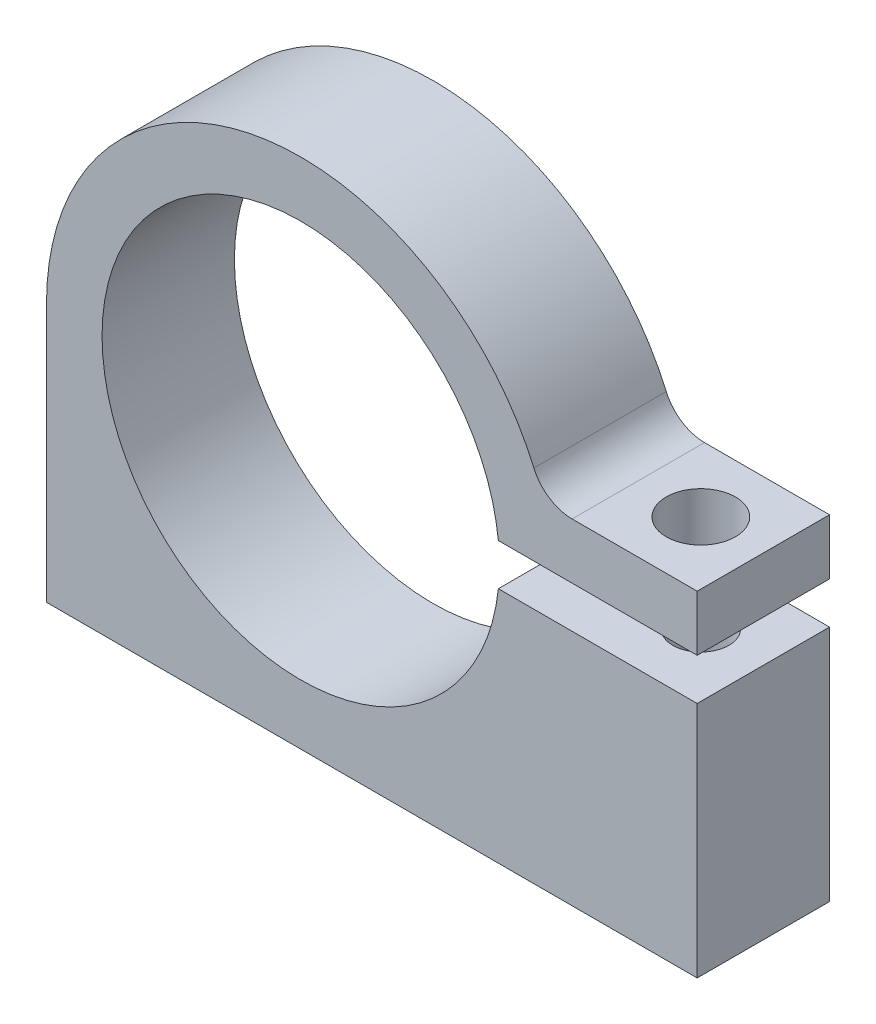
from build123d import *

# Parameters (mm, degrees)
BOSS_EXTRUDE1_DEPTH        = 9.525
F_10_CLEARANCE_HOLE1_D     = 4.9784
F_10_CLEARANCE_HOLE1_DEPTH = 4
F_10_CLEARANCE_HOLE1_TIP   = 1.495662253
F_10_32_TAPPED_HOLE1_D     = 4.0386
F_10_32_TAPPED_HOLE2_D     = 4.0386
F_10_32_TAPPED_HOLE2_DEPTH = 7
F_10_32_TAPPED_HOLE2_TIP   = 1.213317848


with BuildPart() as part:
    # Sketch1 → Boss-Extrude1 (new body)
    with BuildSketch(Plane.XY):
        with BuildLine():
            ThreePointArc((14.221111068, -1.5), (-14.3, 0), (14.221111068, 1.5))
            Line((14.221111068, 1.5), (28.530488985, 1.5))
            Line((28.530488985, 1.5), (28.530488985, 5.5))
            Line((28.530488985, 5.5), (19.530488985, 5.5))
            ThreePointArc((19.530488985, 5.5), (17.886036082, 5.990861772), (16.779715889, 7.302816901))
            ThreePointArc((16.779715889, 7.302816901), (-3.729691625, 17.915897979), (-18.3, 0))
            Line((-18.3, 0), (-18.3, -18.61))
            Line((-18.3, -18.61), (28.530488985, -18.61))
            Line((28.530488985, -18.61), (28.530488985, -1.5))
            Line((28.530488985, -1.5), (14.221111068, -1.5))
        make_face()
    extrude(amount=BOSS_EXTRUDE1_DEPTH)

    # #10 Clearance Hole1
    with Locations(Plane(origin=(0, 5.5, 0), x_dir=(1, 0, 0), z_dir=(0, 1, 0))):
        with Locations((24.030488985, -4.7625)):
            Hole(F_10_CLEARANCE_HOLE1_D / 2, depth=F_10_CLEARANCE_HOLE1_DEPTH)
            with Locations((0, 0, -(F_10_CLEARANCE_HOLE1_DEPTH + F_10_CLEARANCE_HOLE1_TIP / 2))):  # 118° drill point
                Cone(0, F_10_CLEARANCE_HOLE1_D / 2, F_10_CLEARANCE_HOLE1_TIP, mode=Mode.SUBTRACT)

    # #10-32 Tapped Hole1 (through all)
    with Locations(Plane(origin=(0, -1.5, 0), x_dir=(1, 0, 0), z_dir=(0, 1, 0))):
        with Locations((24.030488985, -4.7625)):
            Hole(F_10_32_TAPPED_HOLE1_D / 2)

    # #10-32 Tapped Hole2
    with Locations(Plane(origin=(0, -18.61, 0), x_dir=(-1, 0, 0), z_dir=(0, -1, 0))):
        with Locations((12.969511015, -4.7625)):
            Hole(F_10_32_TAPPED_HOLE2_D / 2, depth=F_10_32_TAPPED_HOLE2_DEPTH)
            with Locations((0, 0, -(F_10_32_TAPPED_HOLE2_DEPTH + F_10_32_TAPPED_HOLE2_TIP / 2))):  # 118° drill point
                Cone(0, F_10_32_TAPPED_HOLE2_D / 2, F_10_32_TAPPED_HOLE2_TIP, mode=Mode.SUBTRACT)


solid = part.part
